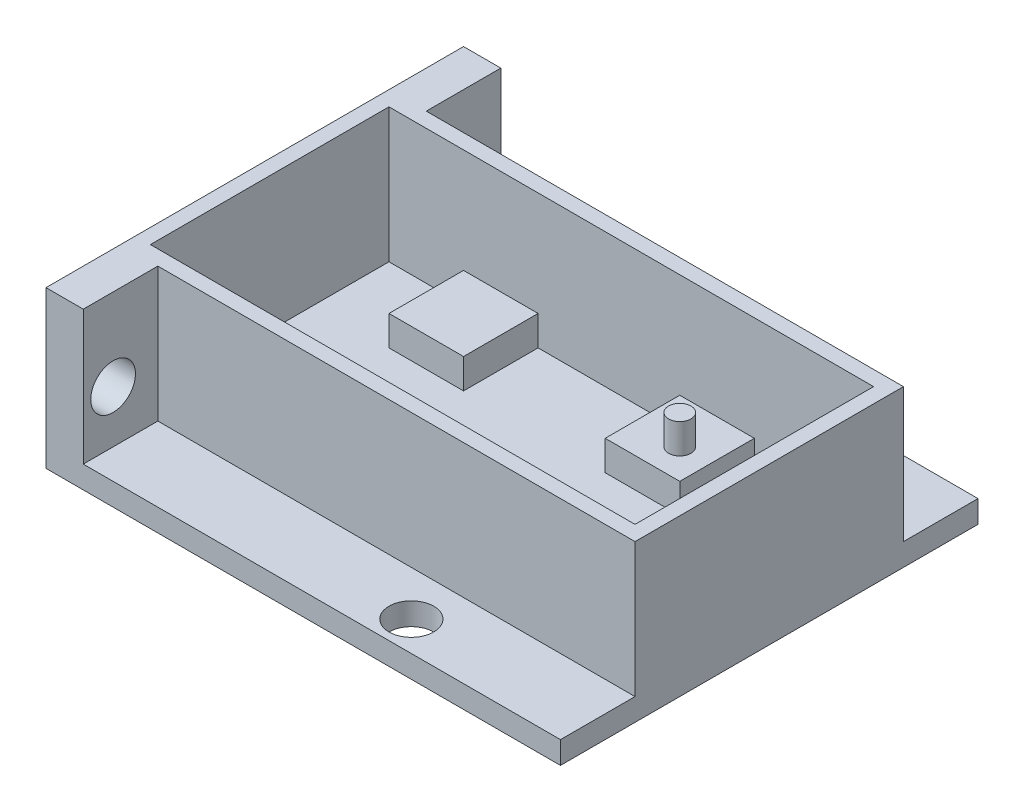
from build123d import *

# Parameters (mm, degrees)
SKETCH1_W           = 32.5
SKETCH1_H           = 16
BOSS_EXTRUDE1_DEPTH = 1.5
SKETCH3_W           = 34.5
SKETCH3_H           = 18
SKETCH3_W_2         = 32.5
SKETCH3_H_2         = 16
BOSS_EXTRUDE2_DEPTH = 10.5
SKETCH4_W           = 5
SKETCH4_H           = 5
BOSS_EXTRUDE3_DEPTH = 2
SKETCH6_W           = 34.5
SKETCH6_H           = 5
BOSS_EXTRUDE5_DEPTH = 1.5
SKETCH7_R           = 1.5
CUT_EXTRUDE1_DEPTH  = 1.5
SKETCH8_W           = 2.5
SKETCH8_H           = 5
BOSS_EXTRUDE6_DEPTH = 9
SKETCH9_R           = 1.5
CUT_EXTRUDE2_DEPTH  = 37.47259245
SKETCH10_R          = 0.75
BOSS_EXTRUDE7_DEPTH = 2


with BuildPart() as part:
    # Sketch1 → Boss-Extrude1 (new body)
    with BuildSketch(Plane(origin=(0, 0, 0), x_dir=(1, 0, 0), z_dir=(0, 1, 0))):
        Rectangle(SKETCH1_W, SKETCH1_H)
    extrude(amount=BOSS_EXTRUDE1_DEPTH)

    # Sketch3 → Boss-Extrude2 (add)
    with BuildSketch(Plane(origin=(0, 0, 0), x_dir=(1, 0, 0), z_dir=(0, 1, 0))):
        Rectangle(SKETCH3_W, SKETCH3_H)
        Rectangle(SKETCH3_W_2, SKETCH3_H_2, mode=Mode.SUBTRACT)
    extrude(amount=BOSS_EXTRUDE2_DEPTH)

    # Sketch4 → Boss-Extrude3 (add)
    with BuildSketch(Plane(origin=(0, 1.5, 0), x_dir=(1, 0, 0), z_dir=(0, 1, 0))):
        with Locations((5.75, 5.5)):
            Rectangle(SKETCH4_W, SKETCH4_H)
        with Locations((5.75, -5.5)):
            Rectangle(SKETCH4_W, SKETCH4_H)
        with Locations((-8.75, 5.5)):
            Rectangle(SKETCH4_W, SKETCH4_H)
        with Locations((-8.75, -5.5)):
            Rectangle(SKETCH4_W, SKETCH4_H)
    extrude(amount=BOSS_EXTRUDE3_DEPTH)

    # Sketch6 → Boss-Extrude5 (add)
    with BuildSketch(Plane(origin=(0, 0, 0), x_dir=(1, 0, 0), z_dir=(0, 1, 0))):
        with Locations((0, 11.5)):
            Rectangle(SKETCH6_W, SKETCH6_H)
        with Locations((0, -11.5)):
            Rectangle(SKETCH6_W, SKETCH6_H)
    extrude(amount=BOSS_EXTRUDE5_DEPTH)

    # Sketch7 → Cut-Extrude1 (cut)
    with BuildSketch(Plane(origin=(0, 1.5, 0), x_dir=(1, 0, 0), z_dir=(0, 1, 0))):
        with Locations(Location((5.25, 12, 0), (0, 0, 270))):
            Circle(SKETCH7_R)
        with Locations(Location((5.25, -12, 0), (0, 0, 90))):
            Circle(SKETCH7_R)
    extrude(amount=-CUT_EXTRUDE1_DEPTH, mode=Mode.SUBTRACT)

    # Sketch8 → Boss-Extrude6 (add)
    with BuildSketch(Plane(origin=(0, 1.5, 0), x_dir=(1, 0, 0), z_dir=(0, 1, 0))):
        with Locations((-16, 11.5)):
            Rectangle(SKETCH8_W, SKETCH8_H)
        with Locations((-16, -11.5)):
            Rectangle(SKETCH8_W, SKETCH8_H)
    extrude(amount=BOSS_EXTRUDE6_DEPTH)

    # Sketch9 → Cut-Extrude2 (cut, through all)
    with BuildSketch(Plane(origin=(-14.75, 0, 0), x_dir=(0, 0, -1), z_dir=(1, 0, 0))):
        with Locations((12, 5)):
            Circle(SKETCH9_R)
        with Locations(Location((-12, 5, 0), (0, 0, 180))):
            Circle(SKETCH9_R)
    extrude(amount=-CUT_EXTRUDE2_DEPTH, mode=Mode.SUBTRACT)

    # Sketch10 → Boss-Extrude7 (add)
    with BuildSketch(Plane(origin=(0, 3.5, 0), x_dir=(1, 0, 0), z_dir=(0, 1, 0))):
        with Locations(Location((6.25, 5, 0), (0, 0, 90))):
            Circle(SKETCH10_R)
        with Locations(Location((6.25, -5, 0), (0, 0, 90))):
            Circle(SKETCH10_R)
    extrude(amount=BOSS_EXTRUDE7_DEPTH)


solid = part.part
